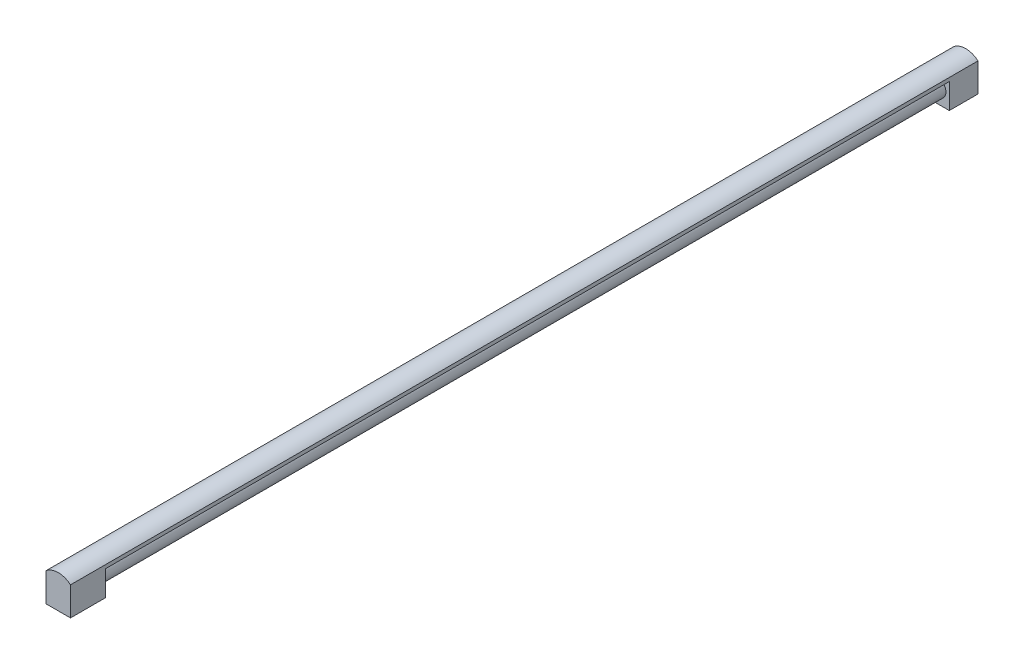
from build123d import *

# Parameters (mm, degrees)
BOSS_EXTRUDE1_DEPTH = 50
BOSS_EXTRUDE2_START = 1206
SKETCH3_R           = 12.7
BOSS_EXTRUDE2_DEPTH = 1206
BOSS_EXTRUDE3_START = 41
BOSS_EXTRUDE3_DEPTH = 41


with BuildPart() as part:
    # Sketch2 → Boss-Extrude1 (new body)
    with BuildSketch(Plane.XY):
        with BuildLine():
            Line((-17.5, -20.5), (17.5, -20.5))
            Line((17.5, -20.5), (17.5, 20.5))
            ThreePointArc((17.5, 20.5), (0, 26.953663944), (-17.5, 20.5))
            Line((-17.5, 20.5), (-17.5, -20.5))
        make_face()
    extrude(amount=BOSS_EXTRUDE1_DEPTH)

    # Sketch3 → Boss-Extrude2 (add)
    with BuildSketch(Plane(origin=(0, 0, 0), x_dir=(-1, 0, 0), z_dir=(0, 0, -1)).offset(BOSS_EXTRUDE2_START)):
        Circle(SKETCH3_R)
        with BuildLine():
            ThreePointArc((17.5, 20.5), (0, 26.953663944), (-17.5, 20.5))
            Line((-17.5, 20.5), (-17.5, 15.42))
            Line((-17.5, 15.42), (17.5, 15.42))
            Line((17.5, 15.42), (17.5, 20.5))
        make_face()
    extrude(amount=-BOSS_EXTRUDE2_DEPTH)

    # Sketch4 → Boss-Extrude3 (add)
    with BuildSketch(Plane(origin=(0, 0, -1206), x_dir=(-1, 0, 0), z_dir=(0, 0, -1)).offset(BOSS_EXTRUDE3_START)):
        with BuildLine():
            Line((-17.5, 20.5), (-17.5, -20.5))
            Line((-17.5, -20.5), (17.5, -20.5))
            Line((17.5, -20.5), (17.5, 20.5))
            ThreePointArc((17.5, 20.5), (0, 26.953663944), (-17.5, 20.5))
        make_face()
    extrude(amount=-BOSS_EXTRUDE3_DEPTH)


solid = part.part
